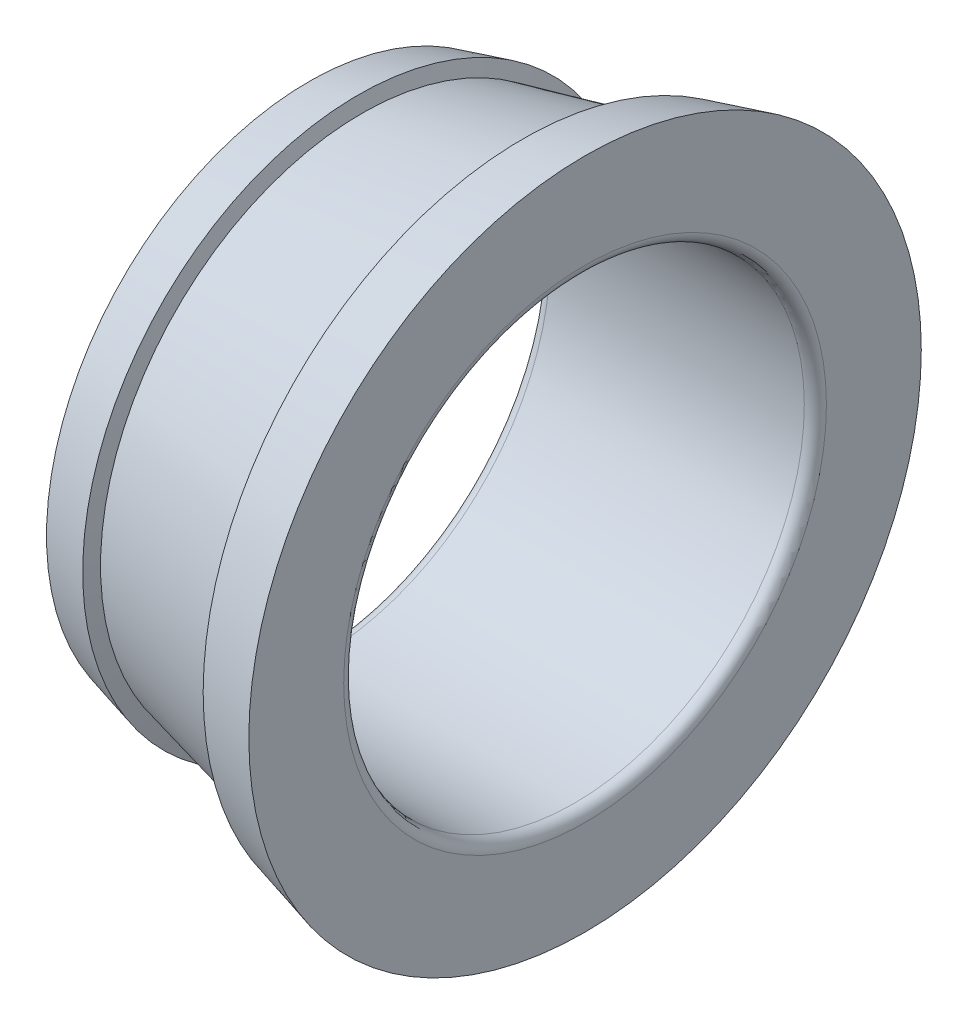
from build123d import *


with BuildPart() as part:
    # Esquisse1 → Base-Révolution (revolve)
    with BuildSketch(Plane.XY, mode=Mode.PRIVATE) as base_r_volution_sk:
        with BuildLine():
            Line((0, 13.1), (0, 18.25))
            Line((0, 18.25), (-3.385649604, 17.342817923))
            Line((-3.385649604, 17.342817923), (-3.108014609, 16.306670018))
            Line((-3.108014609, 16.306670018), (-12.11177275, 14.186566402))
            Line((-12.11177275, 14.186566402), (-12.316296218, 14.949858375))
            Line((-12.316296218, 14.949858375), (-15, 14.230762114))
            Line((-15, 14.230762114), (-15, 13.1))
            ThreePointArc((-15, 13.1), (-14.824264069, 12.675735931), (-14.4, 12.5))
            Line((-14.4, 12.5), (-0.6, 12.5))
            ThreePointArc((-0.6, 12.5), (-0.175735931, 12.675735931), (0, 13.1))
        make_face()
    revolve(base_r_volution_sk.sketch.rotate(Axis((0, 0, 0), (-1, 0, 0)), 90), axis=Axis((0, 0, 0), (-1, 0, 0)))


solid = part.part
